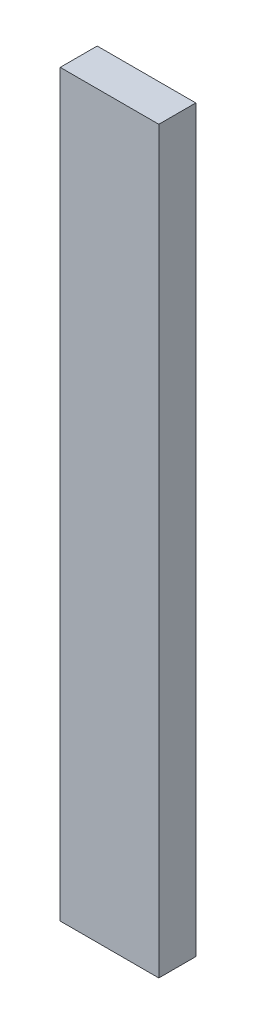
from build123d import *

# Parameters (mm, degrees)
SKETCH1_W           = 50.8
SKETCH1_H           = 381
BOSS_EXTRUDE1_DEPTH = 19.05


with BuildPart() as part:
    # Sketch1 → Boss-Extrude1 (new body)
    with BuildSketch(Plane.XY):
        Rectangle(SKETCH1_W, SKETCH1_H)
    extrude(amount=BOSS_EXTRUDE1_DEPTH)


solid = part.part
